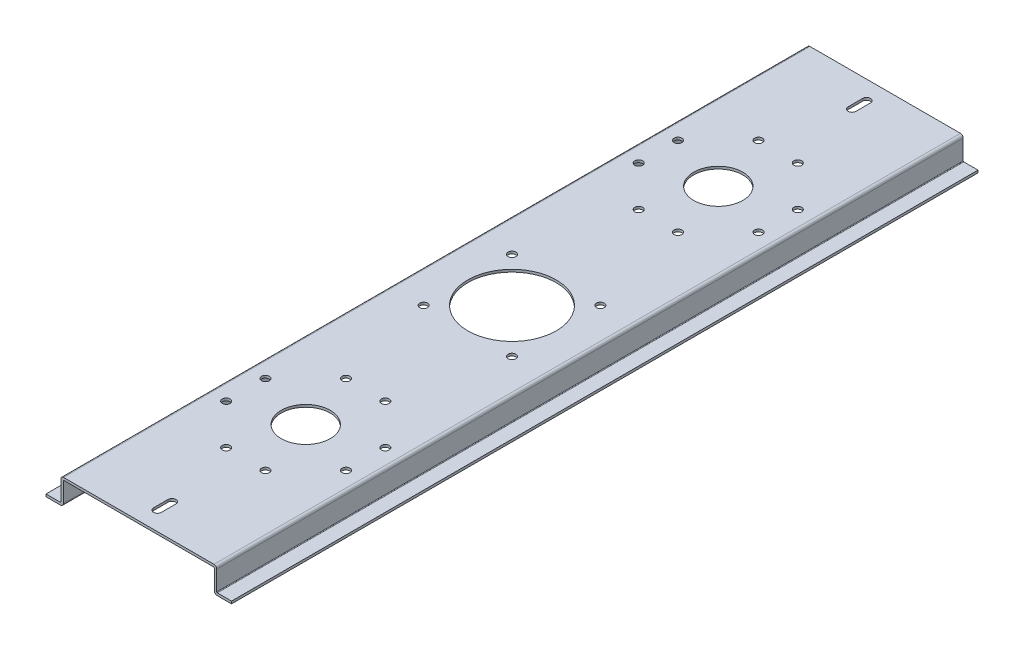
from build123d import *

# Parameters (mm, degrees)
BOSS_EXTRUDE1_DEPTH      = 482.6
BOSS_EXTRUDE1_DEPTH_BACK = 482.6
SKETCH2_R                = 57.15
SKETCH2_R_2              = 5.08
SKETCH2_R_3              = 31.75
CUT_EXTRUDE1_DEPTH       = 965.2
FILLET1_R                = 0.79375
FILLET2_R                = 3.571875


with BuildPart() as part:
    # Sketch1 → Boss-Extrude1 (new, two sides: drawn at the far end of the back side and taken through both)
    with BuildSketch(Plane.XY.offset(-BOSS_EXTRUDE1_DEPTH_BACK)):
        Polygon((0, 0), (100.80625, 0), (100.80625, -29.845), (119.9515, -29.845), (119.9515, -33.02), (97.63125, -33.02), (97.63125, -3.175), (-97.63125, -3.175), (-97.63125, -33.02), (-119.9515, -33.02), (-119.9515, -29.845), (-100.80625, -29.845), (-100.80625, 0), align=None)
    extrude(amount=BOSS_EXTRUDE1_DEPTH + BOSS_EXTRUDE1_DEPTH_BACK)

    # Sketch2 → Cut-Extrude1 (cut)
    with BuildSketch(Plane(origin=(0, 0, 0), x_dir=(1, 0, 0), z_dir=(0, 1, 0))):
        with Locations(Location((0, 0, 0), (0, 0, 270))):
            Circle(SKETCH2_R)
        with Locations(Location((57.15, 57.15, 0), (0, 0, 270))):
            Circle(SKETCH2_R_2)
        with Locations(Location((57.15, -57.15, 0), (0, 0, 270))):
            Circle(SKETCH2_R_2)
        with Locations(Location((-57.15, -57.15, 0), (0, 0, 270))):
            Circle(SKETCH2_R_2)
        with Locations(Location((-57.15, 57.15, 0), (0, 0, 270))):
            Circle(SKETCH2_R_2)
        with Locations(Location((0, -266.7, 0), (0, 0, 270))):
            Circle(SKETCH2_R_3)
        with Locations(Location((77.47, -241.3, 0), (0, 0, 270))):
            Circle(SKETCH2_R_2)
        with Locations(Location((77.47, -292.1, 0), (0, 0, 270))):
            Circle(SKETCH2_R_2)
        with Locations(Location((-25.4, -344.17, 0), (0, 0, 270))):
            Circle(SKETCH2_R_2)
        with Locations(Location((25.4, -344.17, 0), (0, 0, 270))):
            Circle(SKETCH2_R_2)
        with Locations(Location((-77.47, -241.3, 0), (0, 0, 270))):
            Circle(SKETCH2_R_2)
        with Locations(Location((-77.47, -292.1, 0), (0, 0, 270))):
            Circle(SKETCH2_R_2)
        with Locations(Location((25.4, -189.23, 0), (0, 0, 270))):
            Circle(SKETCH2_R_2)
        with Locations(Location((-25.4, -189.23, 0), (0, 0, 270))):
            Circle(SKETCH2_R_2)
        with Locations(Location((-25.4, 189.23, 0), (0, 0, 270))):
            Circle(SKETCH2_R_2)
        with Locations(Location((77.47, 241.3, 0), (0, 0, 270))):
            Circle(SKETCH2_R_2)
        with Locations(Location((25.4, 189.23, 0), (0, 0, 270))):
            Circle(SKETCH2_R_2)
        with Locations(Location((-77.47, 241.3, 0), (0, 0, 270))):
            Circle(SKETCH2_R_2)
        with Locations(Location((0, 266.7, 0), (0, 0, 270))):
            Circle(SKETCH2_R_3)
        with Locations(Location((77.47, 292.1, 0), (0, 0, 270))):
            Circle(SKETCH2_R_2)
        with Locations(Location((-77.47, 292.1, 0), (0, 0, 270))):
            Circle(SKETCH2_R_2)
        with Locations(Location((-25.4, 344.17, 0), (0, 0, 270))):
            Circle(SKETCH2_R_2)
        with Locations(Location((25.4, 344.17, 0), (0, 0, 270))):
            Circle(SKETCH2_R_2)
        with BuildLine():
            Line((-5.08, -458.47), (-5.08, -439.674))
            ThreePointArc((-5.08, -439.674), (0, -434.594), (5.08, -439.674))
            Line((5.08, -439.674), (5.08, -458.47))
            ThreePointArc((5.08, -458.47), (0, -463.55), (-5.08, -458.47))
        make_face()
        with BuildLine():
            Line((-5.08, 458.47), (-5.08, 439.674))
            ThreePointArc((-5.08, 439.674), (0, 434.594), (5.08, 439.674))
            Line((5.08, 439.674), (5.08, 458.47))
            ThreePointArc((5.08, 458.47), (0, 463.55), (-5.08, 458.47))
        make_face()
    extrude(amount=-CUT_EXTRUDE1_DEPTH, mode=Mode.SUBTRACT)

    # Fillet1
    fillet1_edges = [part.edges().sort_by_distance(p)[0] for p in [
        (100.80625, -29.845, 0),
        (97.63125, -3.175, 0),
        (-97.63125, -3.175, 0),
        (-100.80625, -29.845, 0),
    ]]
    fillet(fillet1_edges, radius=FILLET1_R)

    # Fillet2
    fillet2_edges = [part.edges().sort_by_distance(p)[0] for p in [
        (100.80625, 0, 0),
        (97.63125, -33.02, 0),
        (-97.63125, -33.02, 0),
        (-100.80625, 0, 0),
    ]]
    fillet(fillet2_edges, radius=FILLET2_R)


solid = part.part
